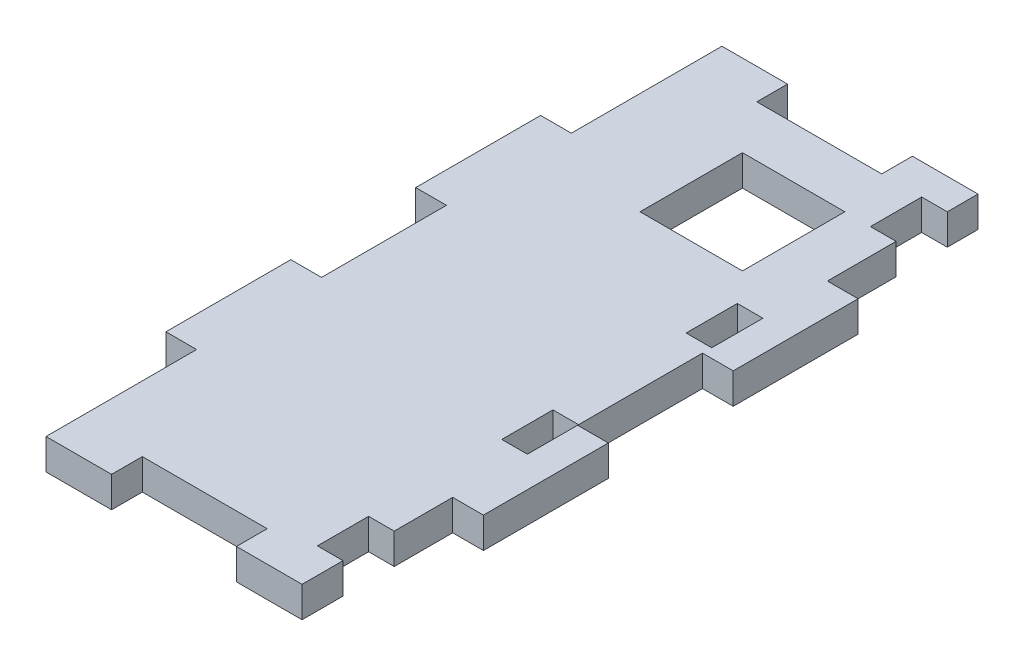
from build123d import *

# Parameters (mm, degrees)
BOSS_EXTRUDE1_DEPTH = 6
SKETCH3_W           = 20
SKETCH3_H           = 20
SKETCH3_W_2         = 5
SKETCH3_H_2         = 10
CUT_EXTRUDE1_DEPTH  = 6


with BuildPart() as part:
    # Sketch2 → Boss-Extrude1 (new body)
    with BuildSketch(Plane(origin=(0, 0, 0), x_dir=(1, 0, 0), z_dir=(0, 1, 0))):
        Polygon((121, 270), (121, 240.585), (115, 240.585), (115, 216.195), (121, 216.195), (121, 191.805), (115, 191.805), (115, 167.415), (121, 167.415), (121, 143.025), (121, 138), (133.805, 138), (133.805, 144), (158.195, 144), (158.195, 138), (171, 138), (171, 167.415), (177, 167.415), (177, 191.805), (171, 191.805), (171, 216.195), (177, 216.195), (177, 240.585), (171, 240.585), (171, 264.975), (171, 270), (158.195, 270), (158.195, 264), (133.805, 264), (133.805, 270), align=None)
    extrude(amount=BOSS_EXTRUDE1_DEPTH)

    # Sketch3 → Cut-Extrude1 (cut)
    with BuildSketch(Plane(origin=(0, 6, 0), x_dir=(1, 0, 0), z_dir=(0, 1, 0))):
        with Locations((151, 244)):
            Rectangle(SKETCH3_W, SKETCH3_H)
        with Locations((168.5, 223)):
            Rectangle(SKETCH3_W_2, SKETCH3_H_2)
        with Locations((168.5, 259)):
            Rectangle(SKETCH3_W_2, SKETCH3_H_2)
        with Locations((168.5, 187)):
            Rectangle(SKETCH3_W_2, SKETCH3_H_2)
        with Locations((168.5, 151)):
            Rectangle(SKETCH3_W_2, SKETCH3_H_2)
    extrude(amount=-CUT_EXTRUDE1_DEPTH, mode=Mode.SUBTRACT)


solid = part.part
